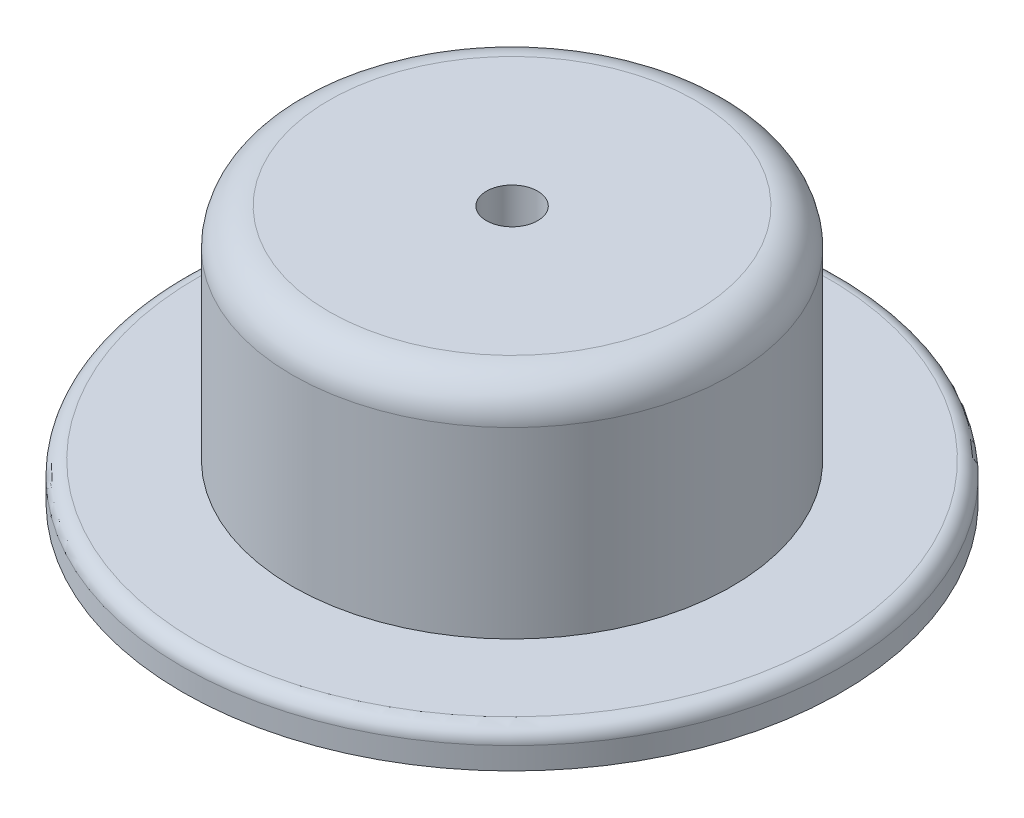
from build123d import *

# Parameters (mm, degrees)
SKETCH1_R           = 4.5
SKETCH1_R_2         = 0.375
BOSS_EXTRUDE1_DEPTH = 0.5
SKETCH2_R           = 3
SKETCH2_R_2         = 0.35
BOSS_EXTRUDE2_DEPTH = 3
FILLET1_R           = 0.5
FILLET2_R           = 0.2


with BuildPart() as part:
    # Sketch1 → Boss-Extrude1 (new body)
    with BuildSketch(Plane(origin=(0, 0, 0), x_dir=(1, 0, 0), z_dir=(0, 1, 0))):
        with Locations(Location((0, 0, 0), (0, 0, 270))):
            Circle(SKETCH1_R)
        with Locations(Location((0, 0, 0), (0, 0, 270))):
            Circle(SKETCH1_R_2, mode=Mode.SUBTRACT)
    extrude(amount=BOSS_EXTRUDE1_DEPTH)

    # Sketch2 → Boss-Extrude2 (add)
    with BuildSketch(Plane(origin=(0, 0.5, 0), x_dir=(1, 0, 0), z_dir=(0, 1, 0))):
        with Locations(Location((0, 0, 0), (0, 0, 270))):
            Circle(SKETCH2_R)
        with Locations(Location((0, 0, 0), (0, 0, 270))):
            Circle(SKETCH2_R_2, mode=Mode.SUBTRACT)
    extrude(amount=BOSS_EXTRUDE2_DEPTH)

    # Fillet1
    fillet1_edges = [part.edges().sort_by_distance(p)[0] for p in [
        (0, 3.5, -3),
    ]]
    fillet(fillet1_edges, radius=FILLET1_R)

    # Fillet2
    fillet2_edges = [part.edges().sort_by_distance(p)[0] for p in [
        (0, 0.5, -4.5),
    ]]
    fillet(fillet2_edges, radius=FILLET2_R)


solid = part.part
